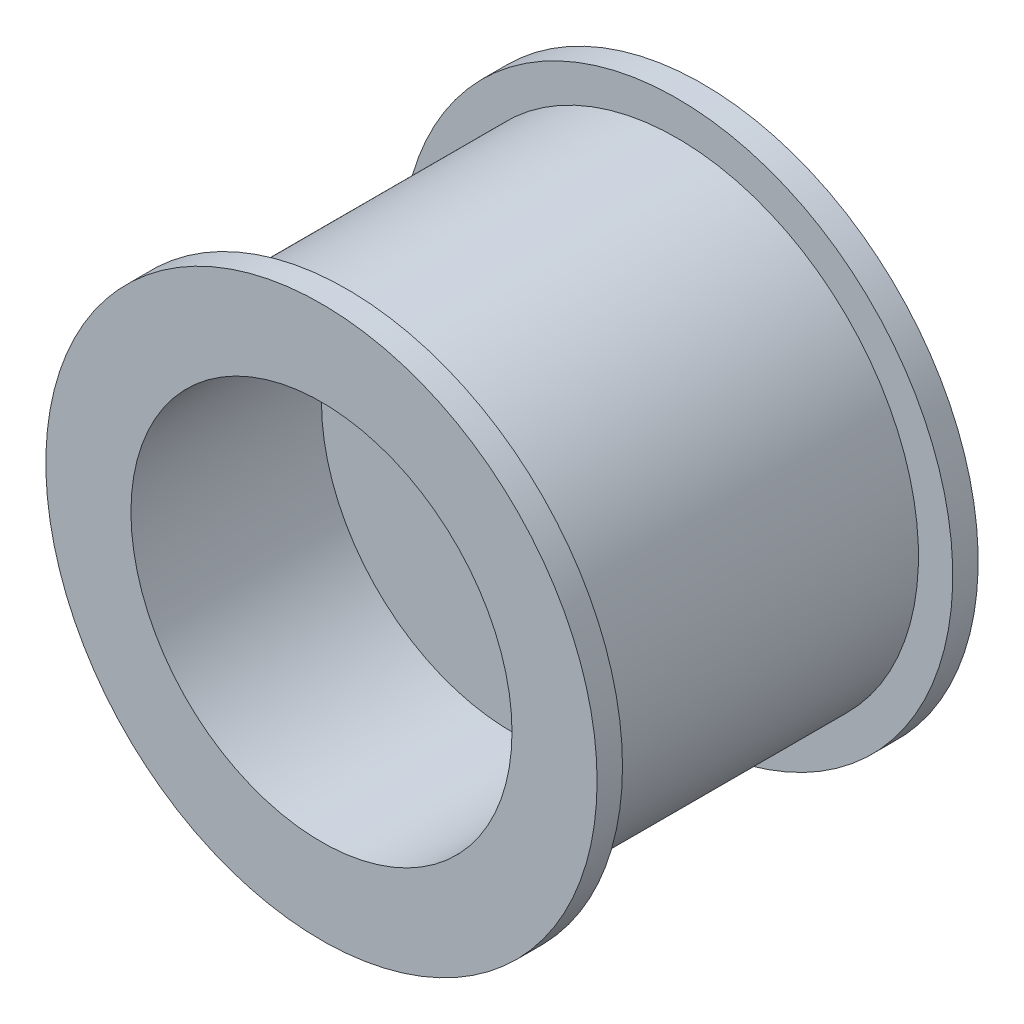
from build123d import *

# Parameters (mm, degrees)
CROQUIS2_R              = 19
SALIENTE_EXTRUIR1_DEPTH = 26
CROQUIS3_R              = 21.7
SALIENTE_EXTRUIR2_DEPTH = 2
SALIENTE_EXTRUIR3_START = 2
CROQUIS4_R              = 21.7
SALIENTE_EXTRUIR3_DEPTH = 2
CROQUIS5_R              = 15
CORTAR_EXTRUIR1_DEPTH   = 15
CROQUIS6_R              = 3
CORTAR_EXTRUIR2_DEPTH   = 35.158161543
CROQUIS7_R              = 3
CORTAR_EXTRUIR3_DEPTH   = 10


with BuildPart() as part:
    # Croquis2 → Saliente-Extruir1 (new body)
    with BuildSketch(Plane.XY):
        with Locations(Location((0, 0, 0), (0, 0, 180))):
            Circle(CROQUIS2_R)
    extrude(amount=SALIENTE_EXTRUIR1_DEPTH)

    # Croquis3 → Saliente-Extruir2 (add)
    with BuildSketch(Plane.XY.offset(26)):
        Circle(CROQUIS3_R)
    extrude(amount=SALIENTE_EXTRUIR2_DEPTH)

    # Croquis4 → Saliente-Extruir3 (add)
    with BuildSketch(Plane(origin=(0, 0, 0), x_dir=(-1, 0, 0), z_dir=(0, 0, -1)).offset(SALIENTE_EXTRUIR3_START)):
        with Locations(Location((0, 0, 0), (0, 0, 180))):
            Circle(CROQUIS4_R)
    extrude(amount=-SALIENTE_EXTRUIR3_DEPTH)

    # Croquis5 → Cortar-Extruir1 (cut)
    with BuildSketch(Plane.XY.offset(28)):
        Circle(CROQUIS5_R)
    extrude(amount=-CORTAR_EXTRUIR1_DEPTH, mode=Mode.SUBTRACT)

    # Croquis6 → Cortar-Extruir2 (cut, through all)
    with BuildSketch(Plane.XY.offset(13)):
        Circle(CROQUIS6_R)
    extrude(amount=-CORTAR_EXTRUIR2_DEPTH, mode=Mode.SUBTRACT)

    # Croquis7 → Cortar-Extruir3 (cut)
    with BuildSketch(Plane(origin=(0, 0, -2), x_dir=(-1, 0, 0), z_dir=(0, 0, -1))):
        with Locations((0, 12.5)):
            Circle(CROQUIS7_R)
        with Locations((10.825317547, 6.25)):
            Circle(CROQUIS7_R)
        with Locations((10.825317547, -6.25)):
            Circle(CROQUIS7_R)
        with Locations((0, -12.5)):
            Circle(CROQUIS7_R)
        with Locations((-10.825317547, -6.25)):
            Circle(CROQUIS7_R)
        with Locations((-10.825317547, 6.25)):
            Circle(CROQUIS7_R)
    extrude(amount=-CORTAR_EXTRUIR3_DEPTH, mode=Mode.SUBTRACT)


solid = part.part
